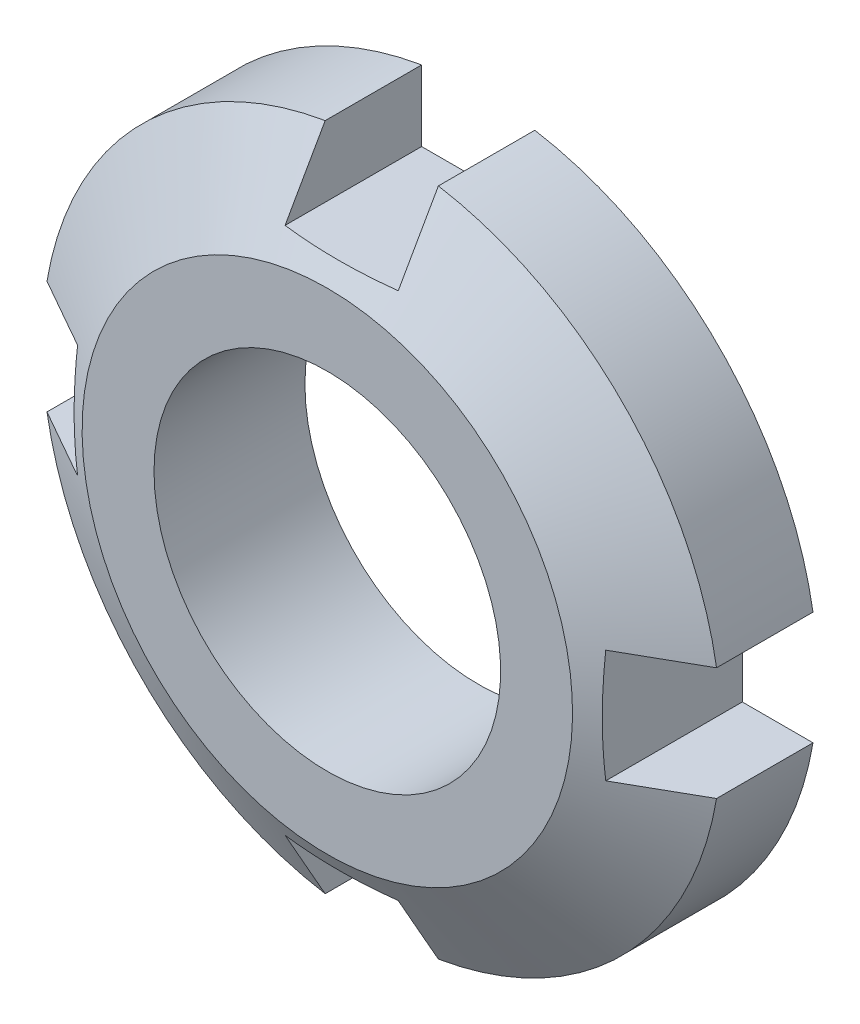
from build123d import *

# Parameters (mm, degrees)
TAP1_D             = 9.188
SKETCH4_W          = 3
SKETCH4_H          = 2
SKETCH4_W_2        = 2
SKETCH4_H_2        = 3
CUT_EXTRUDE1_DEPTH = 14.341664064


with BuildPart() as part:
    # Sketch1 → Revolve1 (revolve)
    with BuildSketch(Plane(origin=(0, 0, 0), x_dir=(0, 0, -1), z_dir=(1, 0, 0))):
        Polygon((0, 9), (-2.556624327, 9), (-4, 6.5), (-4, 0), (0, 0), align=None)
    revolve(axis=Axis((0, 0, 0), (0, 0, 1)))

    # Tap1 (through all)
    with Locations(Plane(origin=(0, 0, 0), x_dir=(-1, 0, 0), z_dir=(0, 0, -1))):
        with Locations((0, 0)):
            Hole(TAP1_D / 2)

    # Sketch4 → Cut-Extrude1 (cut, through all)
    with BuildSketch(Plane.XY):
        with Locations((0, 8)):
            Rectangle(SKETCH4_W, SKETCH4_H)
        with Locations((-8, 0)):
            Rectangle(SKETCH4_W_2, SKETCH4_H_2)
        with Locations((8, 0)):
            Rectangle(SKETCH4_W_2, SKETCH4_H_2)
        with Locations((0, -8)):
            Rectangle(SKETCH4_W, SKETCH4_H)
    extrude(amount=CUT_EXTRUDE1_DEPTH, mode=Mode.SUBTRACT)


solid = part.part
